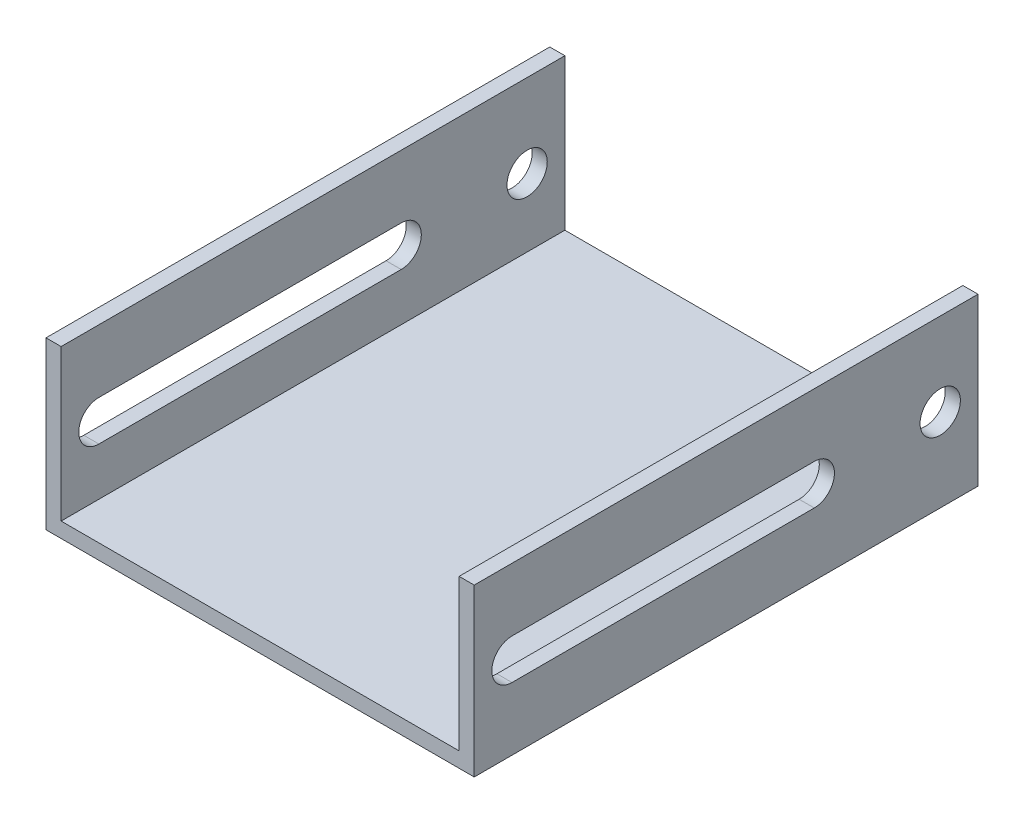
from build123d import *

# Parameters (mm, degrees)
SKETCH_1_W          = 85
SKETCH_1_H          = 100
EXTRUDE_1_DEPTH     = 3
SKETCH_2_W          = 3
SKETCH_2_H          = 100
EXTRUDE_2_DEPTH     = 30
CUT_EXTRUDE_1_REACH = 105.99
SKETCH_3_R          = 4


with BuildPart() as part:
    # 草图1 → 凸台-拉伸1 (new body)
    with BuildSketch(Plane(origin=(0, 0, 0), x_dir=(1, 0, 0), z_dir=(0, 1, 0))):
        Rectangle(SKETCH_1_W, SKETCH_1_H)
    extrude(amount=EXTRUDE_1_DEPTH)

    # 草图2 → 凸台-拉伸2 (add)
    with BuildSketch(Plane(origin=(0, 3, 0), x_dir=(1, 0, 0), z_dir=(0, 1, 0))):
        with Locations((-41, 0)):
            Rectangle(SKETCH_2_W, SKETCH_2_H)
        with Locations((41, 0)):
            Rectangle(SKETCH_2_W, SKETCH_2_H)
    extrude(amount=EXTRUDE_2_DEPTH)

    # 切除-拉伸1: up to this face of the body (flat: up to its plane)
    cut_extrude_1_end = Plane(part.part.faces().sort_by_distance((-42.5, 16.5, 0))[0])
    # 草图3 → 切除-拉伸1 (cut, up to the picked face)
    with BuildSketch(Plane(origin=(42.5, 0, 0), x_dir=(0, 0, -1), z_dir=(1, 0, 0)), mode=Mode.PRIVATE) as cut_extrude_1_sk1:
        with Locations((42.5, 16.5)):
            Circle(SKETCH_3_R)
    cut_extrude_1_tool1 = split(extrude(cut_extrude_1_sk1.sketch, amount=-CUT_EXTRUDE_1_REACH, mode=Mode.PRIVATE), bisect_by=cut_extrude_1_end, keep=Keep.BOTH, mode=Mode.PRIVATE)
    # 草图3 → 切除-拉伸1 (cut, up to the picked face)
    with BuildSketch(Plane(origin=(42.5, 0, 0), x_dir=(0, 0, -1), z_dir=(1, 0, 0)), mode=Mode.PRIVATE) as cut_extrude_1_sk2:
        with BuildLine():
            Line((-42.5, 12.5), (17.5, 12.5))
            ThreePointArc((17.5, 12.5), (21.5, 16.5), (17.5, 20.5))
            Line((17.5, 20.5), (-42.5, 20.5))
            ThreePointArc((-42.5, 20.5), (-46.5, 16.5), (-42.5, 12.5))
        make_face()
    cut_extrude_1_tool2 = split(extrude(cut_extrude_1_sk2.sketch, amount=-CUT_EXTRUDE_1_REACH, mode=Mode.PRIVATE), bisect_by=cut_extrude_1_end, keep=Keep.BOTH, mode=Mode.PRIVATE)
    add(cut_extrude_1_tool1.solids().sort_by(Axis((42.5, 16.5, -42.5), (-1, 0, 0)))[0], mode=Mode.SUBTRACT)
    add(cut_extrude_1_tool2.solids().sort_by(Axis((42.5, 16.5, 12.5), (-1, 0, 0)))[0], mode=Mode.SUBTRACT)


solid = part.part
